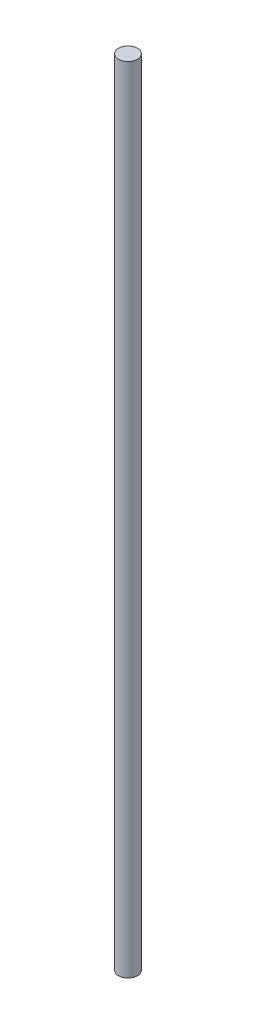
from build123d import *

# Parameters (mm, degrees)
SKETCH1_R           = 6
BOSS_EXTRUDE1_DEPTH = 500


with BuildPart() as part:
    # Sketch1 → Boss-Extrude1 (new body)
    with BuildSketch(Plane(origin=(0, 0, 0), x_dir=(1, 0, 0), z_dir=(0, 1, 0))):
        with Locations(Location((0, 0, 0), (0, 0, 270))):
            Circle(SKETCH1_R)
    extrude(amount=BOSS_EXTRUDE1_DEPTH)


solid = part.part
